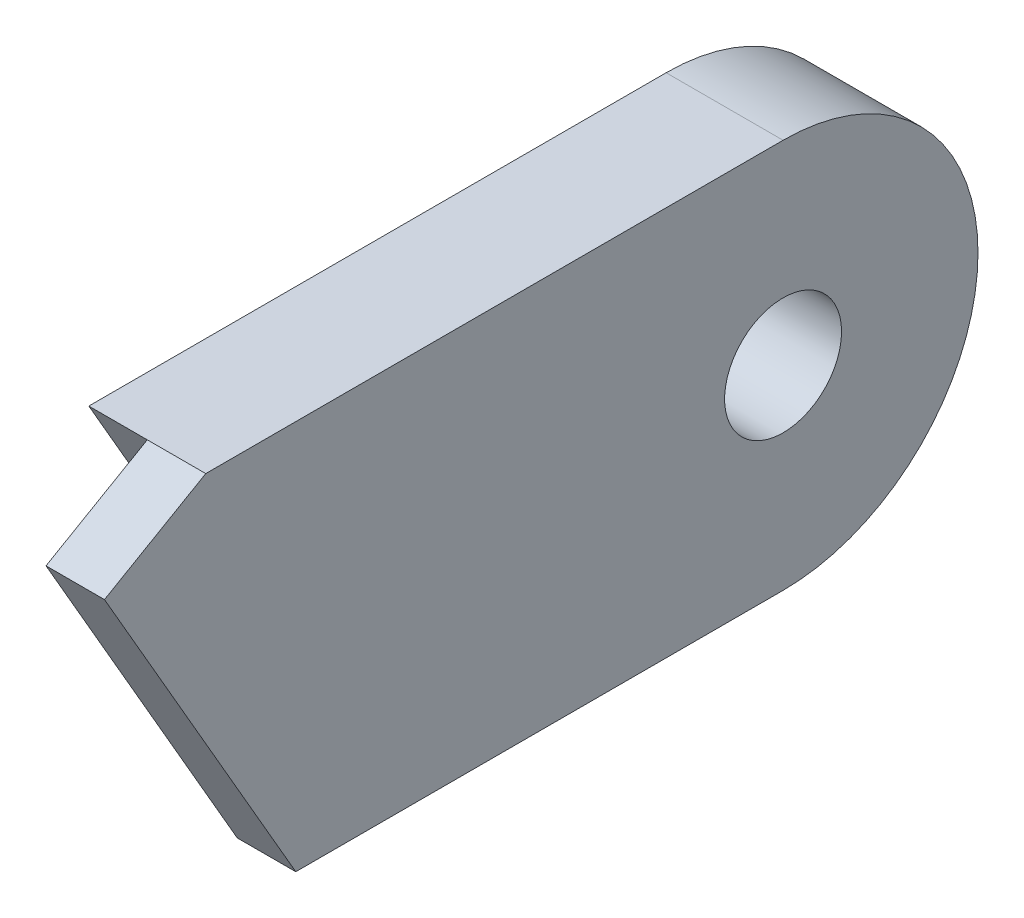
from build123d import *

# Parameters (mm, degrees)
SKETCH1_R           = 3
BOSS_EXTRUDE1_DEPTH = 6
CUT_EXTRUDE1_DEPTH  = 3


with BuildPart() as part:
    # Sketch1 → Boss-Extrude1 (new body)
    with BuildSketch(Plane(origin=(0, 0, 0), x_dir=(0, 0, -1), z_dir=(1, 0, 0))):
        with BuildLine():
            Line((-4.618802154, 20), (-9.814954576, 17))
            Line((-9.814954576, 17), (0, 0))
            Line((0, 0), (25, 0))
            ThreePointArc((25, 0), (35, 10), (25, 20))
            Line((25, 20), (-4.618802154, 20))
        make_face()
        with Locations((25, 10)):
            Circle(SKETCH1_R, mode=Mode.SUBTRACT)
    extrude(amount=BOSS_EXTRUDE1_DEPTH)

    # Sketch2 → Cut-Extrude1 (cut)
    with BuildSketch(Plane.ZY):
        Polygon((9.814954576, 17), (4.618802154, 20), (-6.92820323, 0), (0, 0), align=None)
    extrude(amount=-CUT_EXTRUDE1_DEPTH, mode=Mode.SUBTRACT)


solid = part.part
